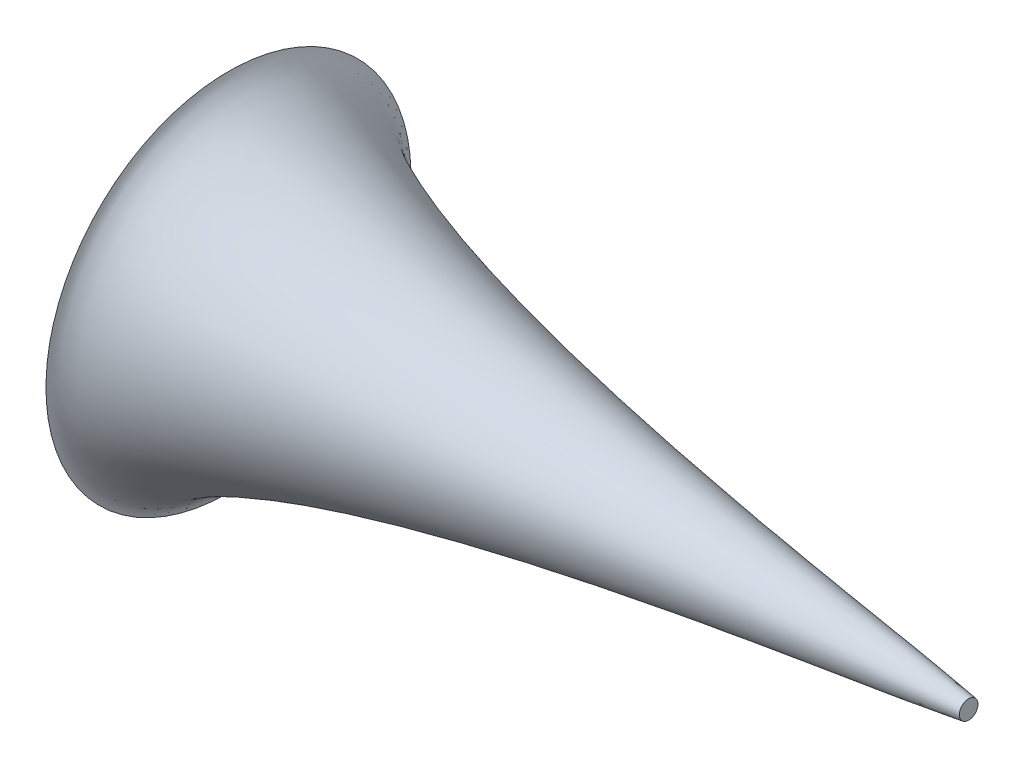
from build123d import *


with BuildPart() as part:
    # Sketch1 → Revolve1 (revolve)
    with BuildSketch(Plane.XY):
        with BuildLine():
            Line((-0.248424231, 25.366518146), (-0.248424231, 0))
            Line((-0.248424231, 0), (102.602827351, 0))
            Line((102.602827351, 0), (102.602827351, 1.296405352))
            add(Edge.make_bspline(
                [(102.602827351, 1.296405352), (101.307835307, 1.486039248), (99.089055064, 1.810949308), (95.982778147, 2.248389792), (93.29341543, 2.606912234), (90.66101806, 2.946491167), (88.002875936, 3.277622623), (85.335391598, 3.619144811), (82.697877775, 3.964263508), (80.162802662, 4.297457479), (77.718537226, 4.62024779), (75.287412003, 4.941809845), (72.884414669, 5.271598878), (70.526156706, 5.599706881), (68.255698379, 5.920221561), (66.013805577, 6.240005405), (63.805852127, 6.565141072), (61.641437102, 6.889759494), (59.539917324, 7.210016209), (57.474198119, 7.531695355), (55.445672137, 7.855773282), (53.47253693, 8.17758974), (51.537886024, 8.498138547), (49.642192899, 8.821738899), (47.785577004, 9.14566571), (45.976749194, 9.46728215), (44.20809438, 9.790326595), (42.478980397, 10.11379815), (40.79248803, 10.435782052), (39.147013981, 10.758362907), (37.541690912, 11.080936173), (35.975380159, 11.402381309), (34.450513587, 11.724031891), (32.964168248, 12.045313543), (31.516428703, 12.365341875), (30.110181868, 12.685092814), (28.737407171, 13.004683744), (27.406772057, 13.322508442), (26.117325802, 13.6388997), (24.86028865, 13.954634402), (23.645020088, 14.268750555), (22.461487686, 14.582385717), (21.318645846, 14.893520352), (20.213820335, 15.202597767), (19.141897883, 15.510284052), (18.111343586, 15.814780957), (17.109034962, 16.118591247), (16.148094759, 16.418636029), (15.215286943, 16.717725088), (14.322535902, 17.012557012), (13.459607851, 17.305528172), (12.633667678, 17.594393295), (11.838000291, 17.880734586), (11.077437693, 18.16281979), (10.346486675, 18.44199271), (9.649848499, 18.716395942), (8.9811395, 18.98782773), (8.34693062, 19.253550351), (7.738024109, 19.516638609), (7.16326903, 19.773212741), (6.611766163, 20.027350676), (6.092456194, 20.274788093), (5.597394913, 20.518611418), (5.131115322, 20.756228917), (4.692492521, 20.987606951), (4.276800948, 21.21472106), (3.887751079, 21.435083266), (3.520196813, 21.650971654), (3.177468923, 21.859981278), (2.857980446, 22.062350941), (2.559090064, 22.259232612), (2.281686268, 22.449430775), (2.024362832, 22.633167878), (1.786599493, 22.810301993), (1.567199405, 22.980988297), (1.36493335, 23.145441227), (1.181063338, 23.301995402), (1.012607391, 23.452480249), (0.858468391, 23.597041763), (0.719443466, 23.734196538), (0.595125282, 23.863646596), (0.482442645, 23.987678376), (0.380535303, 24.106439141), (0.290939558, 24.217382548), (0.213334195, 24.319865215), (0.144079958, 24.417864636), (0.082142951, 24.511964999), (0.027990865, 24.60057494), (-0.017170473, 24.680894415), (-0.054450335, 24.753357303), (-0.086483675, 24.822137774), (-0.16950601, 25.019375846), (-0.211687245, 25.204920969), (-0.248424231, 25.366518146)],
                knots=[0, 0, 0, 0, 0.036698822, 0.062878086, 0.087958795, 0.112775273, 0.13730197, 0.163069142, 0.18818197, 0.211888316, 0.234764032, 0.257314306, 0.280650701, 0.302775523, 0.324076836, 0.3449456, 0.36627441, 0.386655367, 0.406314586, 0.425881303, 0.445276128, 0.463915657, 0.481939052, 0.500263215, 0.517839621, 0.534784938, 0.551778132, 0.56825299, 0.584110308, 0.599921399, 0.615270159, 0.630023218, 0.644755949, 0.658968097, 0.672662756, 0.686330381, 0.699405532, 0.712184575, 0.724690707, 0.736633935, 0.748526533, 0.759886493, 0.770965463, 0.781737905, 0.792054988, 0.802235631, 0.811869371, 0.821422167, 0.830463038, 0.839336628, 0.847784381, 0.856015732, 0.863871224, 0.871495318, 0.878761124, 0.885810752, 0.892489438, 0.898997144, 0.905091387, 0.911088314, 0.916645744, 0.922118017, 0.927217758, 0.932119108, 0.936791843, 0.941122571, 0.945400849, 0.949328667, 0.953074611, 0.956656475, 0.959932526, 0.963109806, 0.966087045, 0.968797857, 0.971422895, 0.973880887, 0.976106854, 0.978193669, 0.980214049, 0.982031703, 0.983669063, 0.985245998, 0.986729884, 0.988056428, 0.989243996, 0.990333825, 0.99142064, 0.992402244, 0.993245077, 0.994003863, 0.994686572, 0.995372366, 1, 1, 1, 1], degree=3))
        make_face()
    revolve(axis=Axis((-0.248424231, 0, 0), (1, 0, 0)))


solid = part.part
